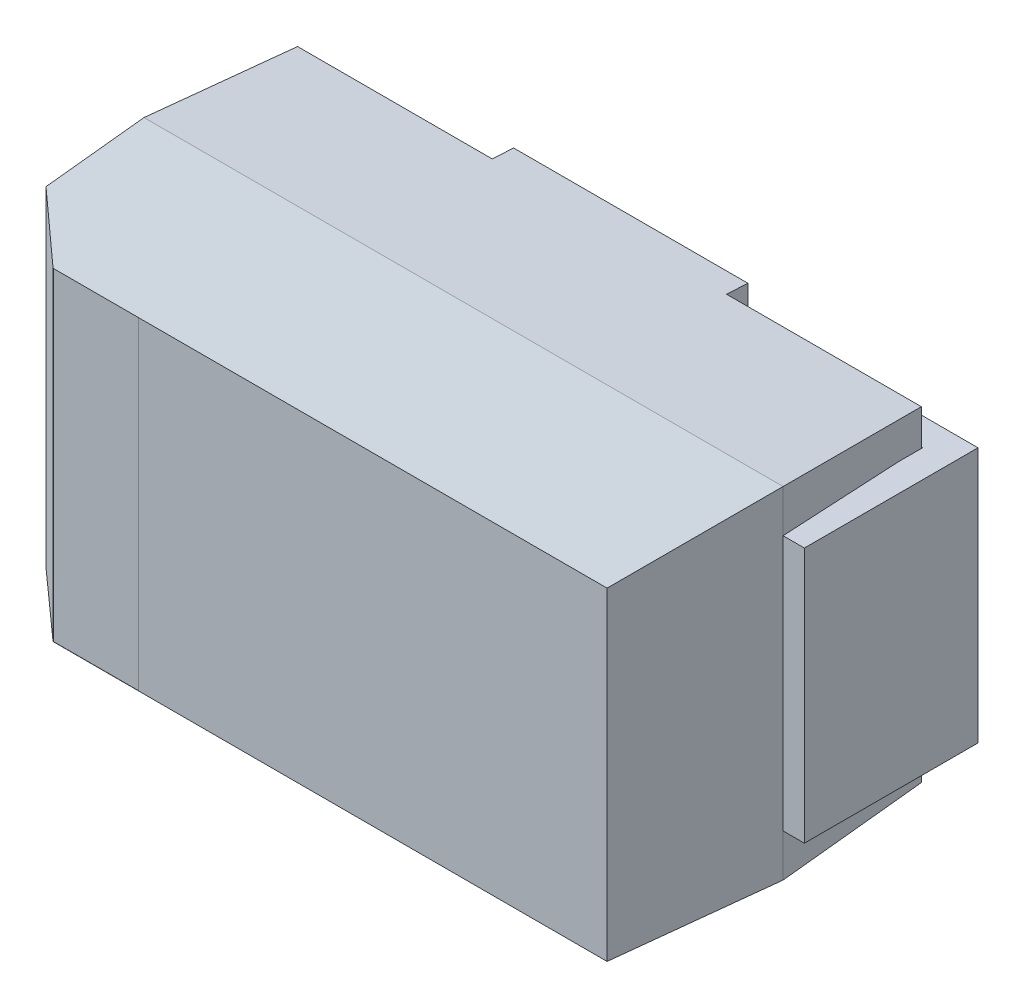
from build123d import *

# Parameters (mm, degrees)
SKETCH1_W                 = 3
SKETCH1_H                 = 1.6
BOSS_EXTRUDE1_DEPTH       = 0.785
DRAFT2_ANGLE              = 3
DRAFT2_OF_MIRROR2_2_ANGLE = 3
CHAMFER1_SIZE             = 0.3
CHAMFER1_SIZE2            = 0.317026351
SKETCH2_W                 = 1.350619213
SKETCH2_H                 = 1.724924769
CUT_EXTRUDE1_DEPTH        = 0.1
BOSS_EXTRUDE3_DEPTH       = 0.6
SKETCH4_W                 = 0.4
SKETCH4_H                 = 1.517719786
CUT_EXTRUDE2_DEPTH        = 0.001


with BuildPart() as part:
    # Sketch1 → Boss-Extrude1 (new body)
    with BuildSketch(Plane.XY.offset(0.815)):
        Rectangle(SKETCH1_W, SKETCH1_H)
    boss_extrude1 = extrude(amount=BOSS_EXTRUDE1_DEPTH)

    # Draft2
    draft2_faces = [part.faces().sort_by_distance(p)[0] for p in [
        (-1.5, 0, 1.2075),
        (0, 0.8, 1.2075),
        (1.5, 0, 1.2075),
        (0, -0.8, 1.2075),
    ]]
    draft(draft2_faces, Plane.XY.offset(0.815), DRAFT2_ANGLE)

    # Mirror2: Boss-Extrude1 across plane
    add(boss_extrude1.mirror(Plane.XY.offset(0.815)))

    # Draft2 of Mirror2 2
    draft2_of_mirror2_2_faces = [part.faces().sort_by_distance(p)[0] for p in [
        (-1.5, 0, 0.4225),
        (0, 0.8, 0.4225),
        (1.5, 0, 0.4225),
        (0, -0.8, 0.4225),
    ]]
    draft(draft2_of_mirror2_2_faces, Plane(origin=(0, 0, 0.815), x_dir=(1, 0, 0), z_dir=(0, 0, -1)), DRAFT2_OF_MIRROR2_2_ANGLE)

    # Chamfer1
    chamfer1_edges = [part.edges().sort_by_distance(p)[0] for p in [
        (-1.458859893, 0, 1.6),
    ]]
    chamfer1_side = [part.faces().sort_by_distance(p)[0] for p in [
        (-1.479610902, 0, 1.204047158),
    ]]
    chamfer(chamfer1_edges, length=CHAMFER1_SIZE, length2=CHAMFER1_SIZE2, reference=chamfer1_side[0])

    # Sketch2 → Cut-Extrude1 (cut)
    with BuildSketch(Plane(origin=(0, 0, 0.03), x_dir=(-1, 0, 0), z_dir=(0, 0, -1))):
        with Locations((-1.225309607, -0.028072916)):
            Rectangle(SKETCH2_W, SKETCH2_H)
    cut_extrude1 = extrude(amount=-CUT_EXTRUDE1_DEPTH, mode=Mode.SUBTRACT)

    # Mirror3: Cut-Extrude1 across plane
    add(cut_extrude1.mirror(Plane(origin=(0, 0, 0), x_dir=(0, 0, 1), z_dir=(1, 0, 0))), mode=Mode.SUBTRACT)

    # Sketch3 → Boss-Extrude3 (add, symmetric)
    with BuildSketch(Plane(origin=(0, 0, 0), x_dir=(1, 0, 0), z_dir=(0, 1, 0))):
        Polygon((0.6, -0.13), (0.6, 0), (1.6, 0), (1.6, -0.815), (1.47, -0.815), (1.47, -0.13), align=None)
    boss_extrude3 = extrude(amount=BOSS_EXTRUDE3_DEPTH, both=True)

    # Mirror4: Boss-Extrude3 across plane
    add(boss_extrude3.mirror(Plane(origin=(0, 0, 0), x_dir=(0, 0, 1), z_dir=(1, 0, 0))))

    # Sketch4 → Cut-Extrude2 (cut)
    with BuildSketch(Plane.XY.offset(1.6)):
        with Locations((-0.941833542, 0)):
            Rectangle(SKETCH4_W, SKETCH4_H)
    extrude(amount=-CUT_EXTRUDE2_DEPTH, mode=Mode.SUBTRACT)


solid = part.part
